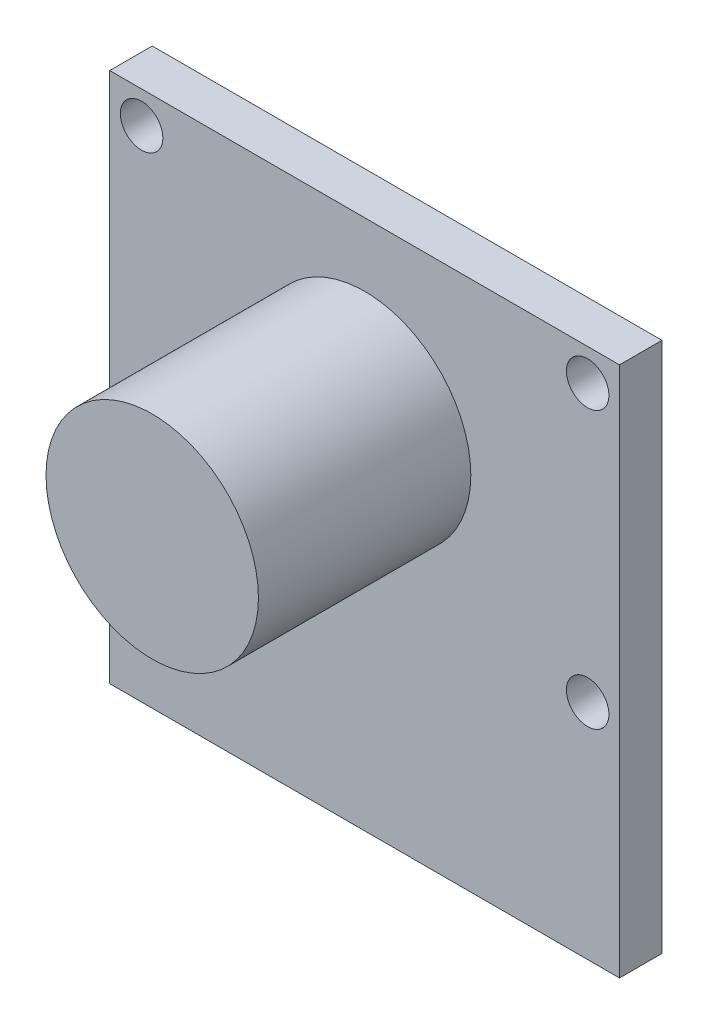
from build123d import *

# Parameters (mm, degrees)
SKETCH_1_W      = 24
SKETCH_1_H      = 25
SKETCH_1_R      = 1
EXTRUDE_1_DEPTH = 2
SKETCH_2_R      = 5
EXTRUDE_2_DEPTH = 10


with BuildPart() as part:
    # 草图1 → 凸台-拉伸1 (new body)
    with BuildSketch(Plane.XY):
        with Locations((-12, 12.5)):
            Rectangle(SKETCH_1_W, SKETCH_1_H)
        with Locations((-22.5, 23.5)):
            Circle(SKETCH_1_R, mode=Mode.SUBTRACT)
        with Locations((-22.5, 10.5)):
            Circle(SKETCH_1_R, mode=Mode.SUBTRACT)
        with Locations((-1.5, 10.5)):
            Circle(SKETCH_1_R, mode=Mode.SUBTRACT)
        with Locations((-1.5, 23.5)):
            Circle(SKETCH_1_R, mode=Mode.SUBTRACT)
    extrude(amount=EXTRUDE_1_DEPTH)

    # 草图2 → 凸台-拉伸2 (add)
    with BuildSketch(Plane.XY.offset(2)):
        with Locations((-12, 17)):
            Circle(SKETCH_2_R)
    extrude(amount=EXTRUDE_2_DEPTH)


solid = part.part
